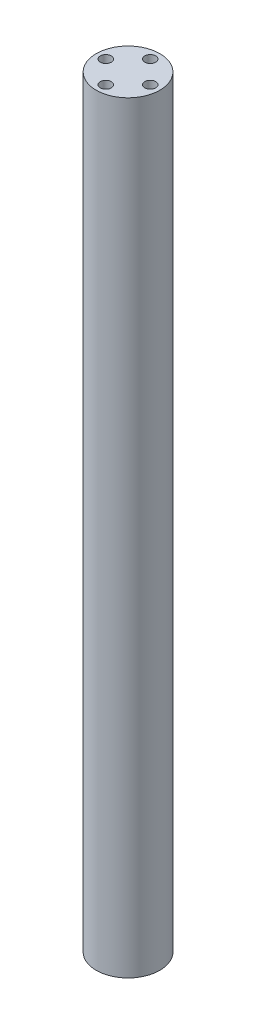
from build123d import *

# Parameters (mm, degrees)
SKETCH1_R           = 12.7
BOSS_EXTRUDE1_DEPTH = 304.8
SKETCH2_R           = 3.96875
CUT_EXTRUDE1_DEPTH  = 76.2
SKETCH3_R           = 2.1971
CUT_EXTRUDE2_DEPTH  = 76.2


with BuildPart() as part:
    # Sketch1 → Boss-Extrude1 (new body)
    with BuildSketch(Plane(origin=(0, 0, 0), x_dir=(1, 0, 0), z_dir=(0, 1, 0))):
        with Locations(Location((0, 0, 0), (0, 0, 90))):
            Circle(SKETCH1_R)
    extrude(amount=BOSS_EXTRUDE1_DEPTH)

    # Sketch2 → Cut-Extrude1 (cut)
    with BuildSketch(Plane.XZ):
        with Locations(Location((0, 0, 0), (0, 0, 270))):
            Circle(SKETCH2_R)
    extrude(amount=-CUT_EXTRUDE1_DEPTH, mode=Mode.SUBTRACT)

    # Sketch3 → Cut-Extrude2 (cut)
    with BuildSketch(Plane(origin=(0, 304.8, 0), x_dir=(1, 0, 0), z_dir=(0, 1, 0))):
        with Locations(Location((0, 8.89, 0), (0, 0, 270))):
            Circle(SKETCH3_R)
        with Locations(Location((8.89, 0, 0), (0, 0, 270))):
            Circle(SKETCH3_R)
        with Locations(Location((0, -8.89, 0), (0, 0, 270))):
            Circle(SKETCH3_R)
        with Locations(Location((-8.89, 0, 0), (0, 0, 270))):
            Circle(SKETCH3_R)
    extrude(amount=-CUT_EXTRUDE2_DEPTH, mode=Mode.SUBTRACT)


solid = part.part
